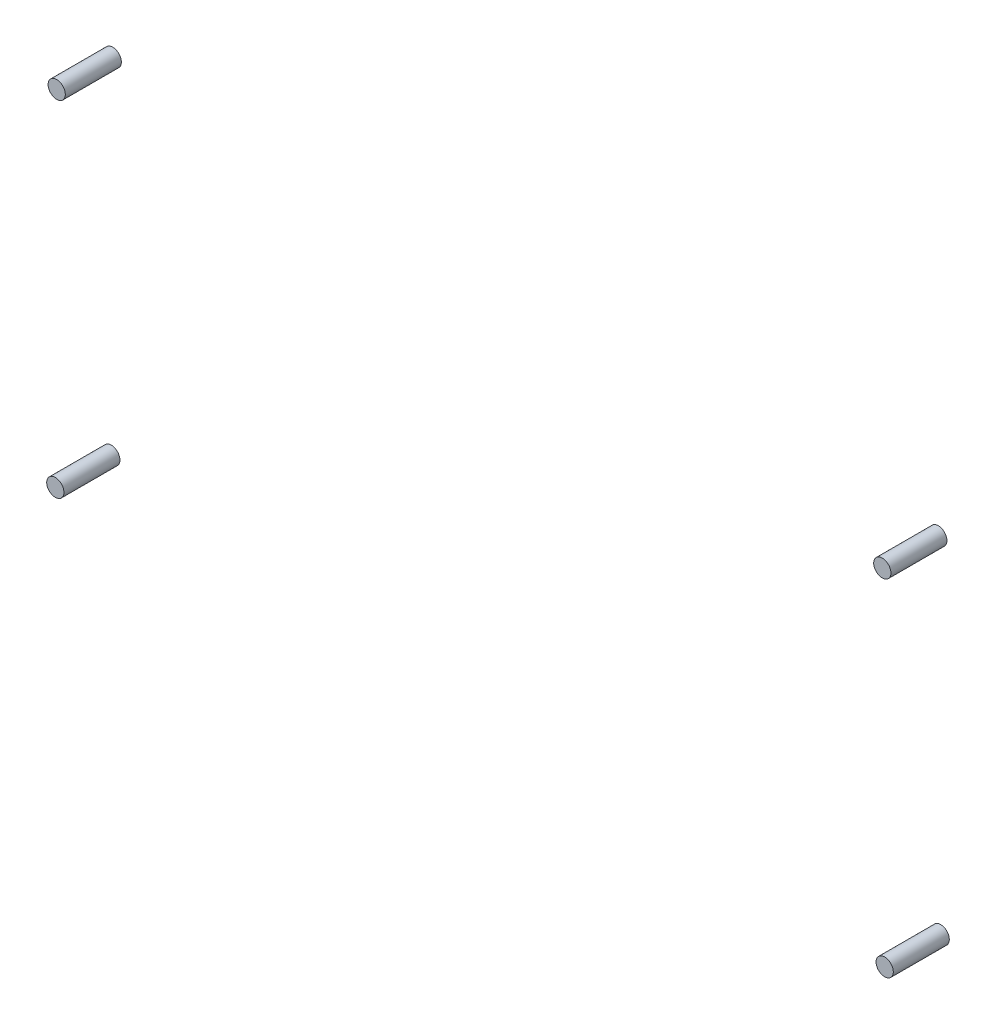
from build123d import *

# Parameters (mm, degrees)
SKETCH_2_R        = 2
EXTRUDE_1_DEPTH   = 13
SKETCH_4_R        = 2
EXTRUDE_2_DEPTH   = 13
SKETCH_5_R        = 2
EXTRUDE_3_DEPTH   = 13
EXTRUDE_3_2_DEPTH = 13


with BuildPart() as part:
    # 草图2 → 凸台-拉伸1 (new body)
    with BuildSketch(Plane.XY.offset(1.6000508)):
        with Locations(Location((47.017442215, -148.796578613, 0), (0, 0, 180))):
            Circle(SKETCH_2_R)
    extrude(amount=EXTRUDE_1_DEPTH)


with BuildPart() as body_2:
    # 草图4 → 凸台-拉伸2 (new body)
    with BuildSketch(Plane.XY.offset(1.6000508)):
        with Locations(Location((238.603472187, -149.177579375, 0), (0, 0, 180))):
            Circle(SKETCH_4_R)
    extrude(amount=EXTRUDE_2_DEPTH)


with BuildPart() as body_3:
    # 草图5 → 凸台-拉伸3 (new body)
    with BuildSketch(Plane.XY.offset(1.6000508)):
        with Locations(Location((239.156530353, -229.060739141, 0), (0, 0, 180))):
            Circle(SKETCH_5_R)
    extrude(amount=EXTRUDE_3_DEPTH)


with BuildPart() as body_4:
    # 草图5 → Extrude 3 2 (new body)
    with BuildSketch(Plane.XY.offset(1.6000508)):
        with Locations(Location((46.693792228, -228.933738887, 0), (0, 0, 180))):
            Circle(SKETCH_5_R)
    extrude(amount=EXTRUDE_3_2_DEPTH)


solid = Compound([part.part, body_2.part, body_3.part, body_4.part])
